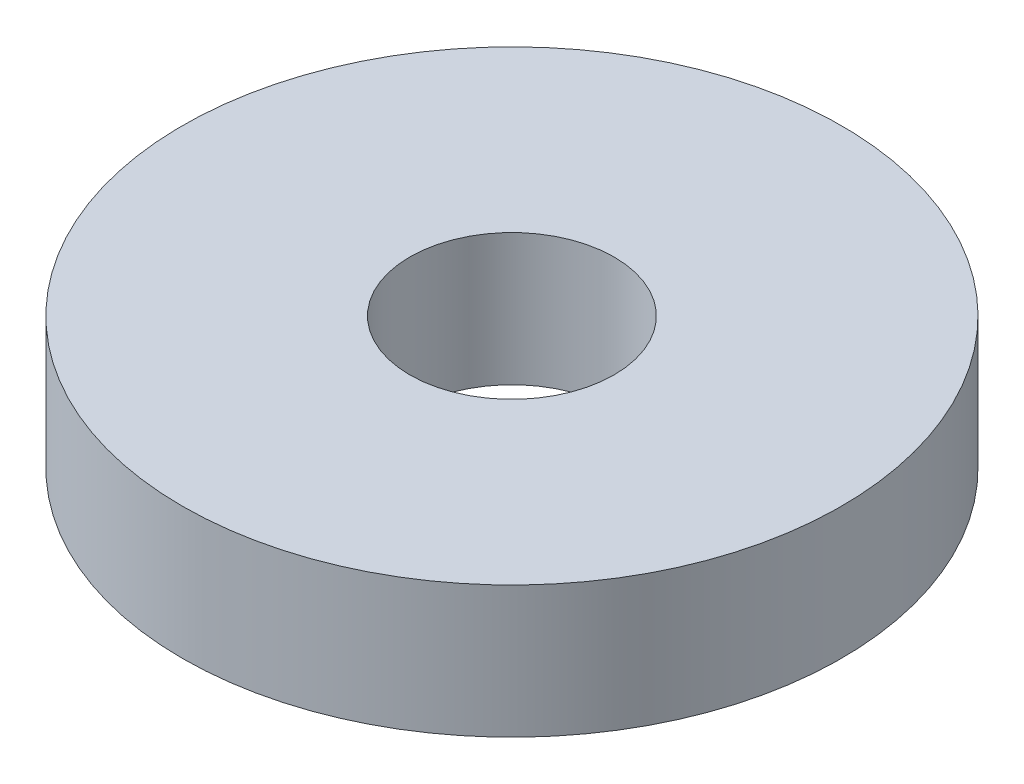
from build123d import *

# Parameters (mm, degrees)
SKETCH_1_R      = 5
SKETCH_1_R_2    = 1.55
EXTRUDE_1_DEPTH = 2


with BuildPart() as part:
    # 草图1 → 凸台-拉伸1 (new body)
    with BuildSketch(Plane(origin=(0, 0, 0), x_dir=(1, 0, 0), z_dir=(0, 1, 0))):
        with Locations(Location((0, 0, 0), (0, 0, 270))):
            Circle(SKETCH_1_R)
        with Locations(Location((0, 0, 0), (0, 0, 270))):
            Circle(SKETCH_1_R_2, mode=Mode.SUBTRACT)
    extrude(amount=EXTRUDE_1_DEPTH)


solid = part.part
